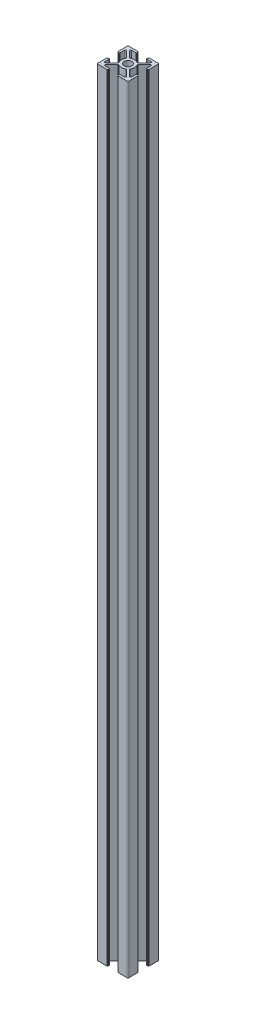
from build123d import *

# Parameters (mm, degrees)
SKETCH1_R           = 2.5
BOSS_EXTRUDE1_DEPTH = 500


with BuildPart() as part:
    # Sketch1 → Boss-Extrude1 (new body)
    with BuildSketch(Plane(origin=(0, 0, 0), x_dir=(1, 0, 0), z_dir=(0, 1, 0))):
        with BuildLine():
            Line((-6.247396549, 8.6), (-3.6, 8.6))
            ThreePointArc((-3.6, 8.6), (-3.317157288, 8.717157288), (-3.2, 9))
            Line((-3.2, 9), (-3.2, 9.6))
            ThreePointArc((-3.2, 9.6), (-3.317157288, 9.882842712), (-3.6, 10))
            Line((-3.6, 10), (-9.5, 10))
            ThreePointArc((-9.5, 10), (-9.853553391, 9.853553391), (-10, 9.5))
            Line((-10, 9.5), (-10, 3.6))
            ThreePointArc((-10, 3.6), (-9.882842712, 3.317157288), (-9.6, 3.2))
            Line((-9.6, 3.2), (-9, 3.2))
            ThreePointArc((-9, 3.2), (-8.717157288, 3.317157288), (-8.6, 3.6))
            Line((-8.6, 3.6), (-8.6, 6.402943725))
            ThreePointArc((-8.6, 6.402943725), (-8.291341716, 6.864883491), (-7.746446609, 6.756497116))
            Line((-7.746446609, 6.756497116), (-3.744782433, 2.75483294))
            ThreePointArc((-3.744782433, 2.75483294), (-3.602407081, 2.46495593), (-3.666932053, 2.148513281))
            ThreePointArc((-3.666932053, 2.148513281), (-4.25, 0), (-3.666932053, -2.148513281))
            ThreePointArc((-3.666932053, -2.148513281), (-3.602407081, -2.46495593), (-3.744782433, -2.75483294))
            Line((-3.744782433, -2.75483294), (-7.636458146, -6.646508652))
            ThreePointArc((-7.636458146, -6.646508652), (-8.251568164, -6.768861642), (-8.6, -6.247396549))
            Line((-8.6, -6.247396549), (-8.6, -3.6))
            ThreePointArc((-8.6, -3.6), (-8.717157288, -3.317157288), (-9, -3.2))
            Line((-9, -3.2), (-9.6, -3.2))
            ThreePointArc((-9.6, -3.2), (-9.882842712, -3.317157288), (-10, -3.6))
            Line((-10, -3.6), (-10, -9.5))
            ThreePointArc((-10, -9.5), (-9.853553391, -9.853553391), (-9.5, -10))
            Line((-9.5, -10), (-3.6, -10))
            ThreePointArc((-3.6, -10), (-3.317157288, -9.882842712), (-3.2, -9.6))
            Line((-3.2, -9.6), (-3.2, -9))
            ThreePointArc((-3.2, -9), (-3.317157288, -8.717157288), (-3.6, -8.6))
            Line((-3.6, -8.6), (-6.247396549, -8.6))
            ThreePointArc((-6.247396549, -8.6), (-6.768861642, -8.251568164), (-6.646508652, -7.636458146))
            Line((-6.646508652, -7.636458146), (-2.75483294, -3.744782433))
            ThreePointArc((-2.75483294, -3.744782433), (-2.46495593, -3.602407081), (-2.148513281, -3.666932053))
            ThreePointArc((-2.148513281, -3.666932053), (0, -4.25), (2.148513281, -3.666932053))
            ThreePointArc((2.148513281, -3.666932053), (2.46495593, -3.602407081), (2.75483294, -3.744782433))
            Line((2.75483294, -3.744782433), (6.646508652, -7.636458146))
            ThreePointArc((6.646508652, -7.636458146), (6.768861642, -8.251568164), (6.247396549, -8.6))
            Line((6.247396549, -8.6), (3.6, -8.6))
            ThreePointArc((3.6, -8.6), (3.317157288, -8.717157288), (3.2, -9))
            Line((3.2, -9), (3.2, -9.6))
            ThreePointArc((3.2, -9.6), (3.317157288, -9.882842712), (3.6, -10))
            Line((3.6, -10), (9.5, -10))
            ThreePointArc((9.5, -10), (9.853553391, -9.853553391), (10, -9.5))
            Line((10, -9.5), (10, -3.6))
            ThreePointArc((10, -3.6), (9.882842712, -3.317157288), (9.6, -3.2))
            Line((9.6, -3.2), (9, -3.2))
            ThreePointArc((9, -3.2), (8.717157288, -3.317157288), (8.6, -3.6))
            Line((8.6, -3.6), (8.6, -6.247396549))
            ThreePointArc((8.6, -6.247396549), (8.251568164, -6.768861642), (7.636458146, -6.646508652))
            Line((7.636458146, -6.646508652), (3.744782433, -2.75483294))
            ThreePointArc((3.744782433, -2.75483294), (3.602407081, -2.46495593), (3.666932053, -2.148513281))
            ThreePointArc((3.666932053, -2.148513281), (4.25, 0), (3.666932053, 2.148513281))
            ThreePointArc((3.666932053, 2.148513281), (3.602407081, 2.46495593), (3.744782433, 2.75483294))
            Line((3.744782433, 2.75483294), (7.636458146, 6.646508652))
            ThreePointArc((7.636458146, 6.646508652), (8.251568164, 6.768861642), (8.6, 6.247396549))
            Line((8.6, 6.247396549), (8.6, 3.6))
            ThreePointArc((8.6, 3.6), (8.717157288, 3.317157288), (9, 3.2))
            Line((9, 3.2), (9.6, 3.2))
            ThreePointArc((9.6, 3.2), (9.882842712, 3.317157288), (10, 3.6))
            Line((10, 3.6), (10, 9.5))
            ThreePointArc((10, 9.5), (9.853553391, 9.853553391), (9.5, 10))
            Line((9.5, 10), (3.6, 10))
            ThreePointArc((3.6, 10), (3.317157288, 9.882842712), (3.2, 9.6))
            Line((3.2, 9.6), (3.2, 9))
            ThreePointArc((3.2, 9), (3.317157288, 8.717157288), (3.6, 8.6))
            Line((3.6, 8.6), (6.247396549, 8.6))
            ThreePointArc((6.247396549, 8.6), (6.768861642, 8.251568164), (6.646508652, 7.636458146))
            Line((6.646508652, 7.636458146), (2.75483294, 3.744782433))
            ThreePointArc((2.75483294, 3.744782433), (2.46495593, 3.602407081), (2.148513281, 3.666932053))
            ThreePointArc((2.148513281, 3.666932053), (0, 4.25), (-2.148513281, 3.666932053))
            ThreePointArc((-2.148513281, 3.666932053), (-2.46495593, 3.602407081), (-2.75483294, 3.744782433))
            Line((-2.75483294, 3.744782433), (-6.646508652, 7.636458146))
            ThreePointArc((-6.646508652, 7.636458146), (-6.768861642, 8.251568164), (-6.247396549, 8.6))
        make_face()
        with Locations(Location((0, 0, 0), (0, 0, 270))):
            Circle(SKETCH1_R, mode=Mode.SUBTRACT)
    extrude(amount=BOSS_EXTRUDE1_DEPTH)


solid = part.part
